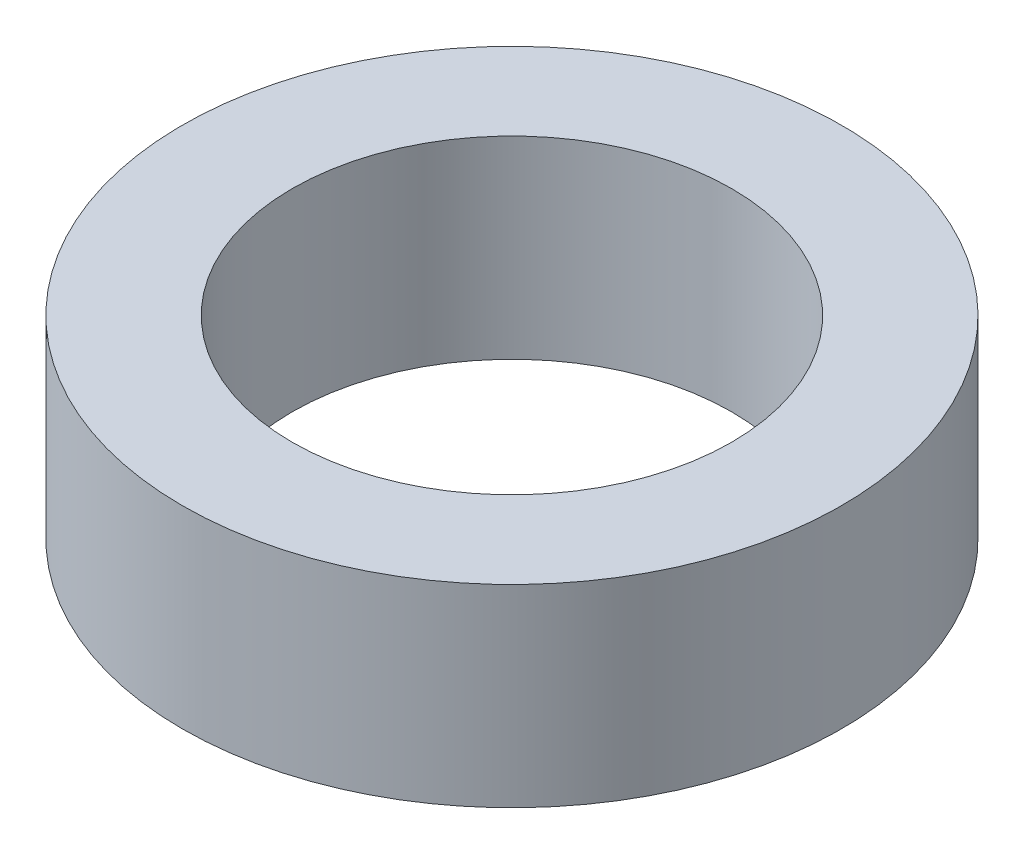
from build123d import *

# Parameters (mm, degrees)
SKETCH1_R           = 9.525
SKETCH1_R_2         = 6.35
BOSS_EXTRUDE1_DEPTH = 5.588


with BuildPart() as part:
    # Sketch1 → Boss-Extrude1 (new body)
    with BuildSketch(Plane(origin=(0, 0, 0), x_dir=(1, 0, 0), z_dir=(0, 1, 0))):
        with Locations(Location((0, 0, 0), (0, 0, 270))):
            Circle(SKETCH1_R)
        with Locations(Location((0, 0, 0), (0, 0, 270))):
            Circle(SKETCH1_R_2, mode=Mode.SUBTRACT)
    extrude(amount=BOSS_EXTRUDE1_DEPTH)


solid = part.part
